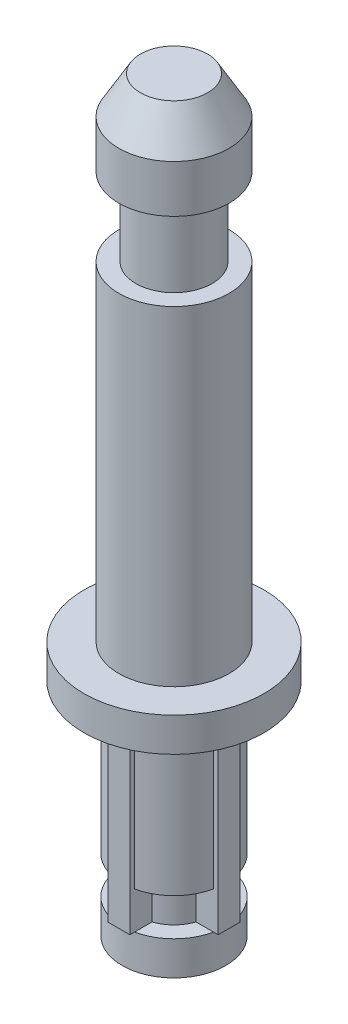
from build123d import *
from build123d.topology import SkipClean

# Parameters (mm, degrees)
SKETCH_1_R          = 3.25
EXTRUDE_1_DEPTH     = 29
CUT_EXTRUDE_START   = -5
SKETCH_2_OUTSIDE_W  = 14.584
SKETCH_2_OUTSIDE_H  = 14.584
SKETCH_2_OUTSIDE_R  = 2.25
CUT_EXTRUDE_1_DEPTH = 4.6
CHAMFER_1_SIZE      = 2.2
CHAMFER_1_SIZE2     = 1.270170592
SKETCH_3_R          = 5.3
EXTRUDE_2_DEPTH     = 2
EXTRUDE_3_DEPTH     = 13
CUT_EXTRUDE_START_2 = -4.2
CUT_EXTRUDE_2_DEPTH = 2.2
SKETCH_6_OUTSIDE_W  = 21.896
SKETCH_6_OUTSIDE_H  = 21.896
SKETCH_6_OUTSIDE_R  = 3.05
CUT_EXTRUDE_3_DEPTH = 2


with BuildPart() as part:
    # Эскиз1 → Бобышка-Вытянуть1 (new body)
    with BuildSketch(Plane(origin=(0, 0, 0), x_dir=(1, 0, 0), z_dir=(0, 1, 0))):
        with Locations(Location((0, 0, 0), (0, 0, 90))):
            Circle(SKETCH_1_R)
    extrude(amount=EXTRUDE_1_DEPTH)

    # Эскиз2 outside → Вырез-Вытянуть1 (cut)
    with BuildSketch(Plane(origin=(0, 29, 0), x_dir=(1, 0, 0), z_dir=(0, 1, 0)).offset(CUT_EXTRUDE_START)):
        Rectangle(SKETCH_2_OUTSIDE_W, SKETCH_2_OUTSIDE_H)
        with Locations(Location((0, 0, 0), (0, 0, 270))):
            Circle(SKETCH_2_OUTSIDE_R, mode=Mode.SUBTRACT)
    extrude(amount=-CUT_EXTRUDE_1_DEPTH, mode=Mode.SUBTRACT)

    # Фаска1
    chamfer_1_edges = [part.edges().sort_by_distance(p)[0] for p in [
        (0, 29, 3.25),
    ]]
    chamfer_1_side = [part.faces().sort_by_distance(p)[0] for p in [
        (0, 26.5, 3.25),
    ]]
    chamfer(chamfer_1_edges, length=CHAMFER_1_SIZE, length2=CHAMFER_1_SIZE2, reference=chamfer_1_side[0])

    # Эскиз3 → Бобышка-Вытянуть2 (add)
    with BuildSketch(Plane.XZ):
        with Locations(Location((0, 0, 0), (0, 0, 270))):
            Circle(SKETCH_3_R)
    extrude(amount=EXTRUDE_2_DEPTH)

    # Эскиз4 → Бобышка-Вытянуть3 (add)
    with BuildSketch(Plane.XZ.offset(2)):
        with BuildLine():
            Line((-0.65, 3.25), (0.65, 3.25))
            Line((0.65, 3.25), (0.65, 2.979932885))
            ThreePointArc((0.65, 2.979932885), (2.156675683, 2.156675683), (2.979932885, 0.65))
            Line((2.979932885, 0.65), (3.25, 0.65))
            Line((3.25, 0.65), (3.25, -0.65))
            Line((3.25, -0.65), (2.979932885, -0.65))
            ThreePointArc((2.979932885, -0.65), (2.156675683, -2.156675683), (0.65, -2.979932885))
            Line((0.65, -2.979932885), (0.65, -3.25))
            Line((0.65, -3.25), (-0.65, -3.25))
            Line((-0.65, -3.25), (-0.65, -2.979932885))
            ThreePointArc((-0.65, -2.979932885), (-2.156675683, -2.156675683), (-2.979932885, -0.65))
            Line((-2.979932885, -0.65), (-3.25, -0.65))
            Line((-3.25, -0.65), (-3.25, 0.65))
            Line((-3.25, 0.65), (-2.979932885, 0.65))
            ThreePointArc((-2.979932885, 0.65), (-2.156675683, 2.156675683), (-0.65, 2.979932885))
            Line((-0.65, 2.979932885), (-0.65, 3.25))
        make_face()
    extrude(amount=EXTRUDE_3_DEPTH)

    # Эскиз5 → Вырез-Вытянуть2 (cut)
    with BuildSketch(Plane.XZ.offset(15).offset(CUT_EXTRUDE_START_2)):
        with BuildLine():
            Line((-2.979932885, 0.65), (-1.94422221, 0.65))
            ThreePointArc((-1.94422221, 0.65), (-1.449568901, 1.449568901), (-0.65, 1.94422221))
            Line((-0.65, 1.94422221), (-0.65, 2.979932885))
            ThreePointArc((-0.65, 2.979932885), (-2.156675683, 2.156675683), (-2.979932885, 0.65))
        make_face()
        with BuildLine():
            Line((2.979932885, 0.65), (1.94422221, 0.65))
            ThreePointArc((1.94422221, 0.65), (1.449568901, 1.449568901), (0.65, 1.94422221))
            Line((0.65, 1.94422221), (0.65, 2.979932885))
            ThreePointArc((0.65, 2.979932885), (2.156675683, 2.156675683), (2.979932885, 0.65))
        make_face()
        with BuildLine():
            Line((-0.65, -1.94422221), (-0.65, -2.979932885))
            ThreePointArc((-0.65, -2.979932885), (-2.156675683, -2.156675683), (-2.979932885, -0.65))
            Line((-2.979932885, -0.65), (-1.94422221, -0.65))
            ThreePointArc((-1.94422221, -0.65), (-1.449568901, -1.449568901), (-0.65, -1.94422221))
        make_face()
        with BuildLine():
            Line((0.65, -2.979932885), (0.65, -1.94422221))
            ThreePointArc((0.65, -1.94422221), (1.449568901, -1.449568901), (1.94422221, -0.65))
            Line((1.94422221, -0.65), (2.979932885, -0.65))
            ThreePointArc((2.979932885, -0.65), (2.156675683, -2.156675683), (0.65, -2.979932885))
        make_face()
    extrude(amount=CUT_EXTRUDE_2_DEPTH, mode=Mode.SUBTRACT)

    # Эскиз6 outside → Вырез-Вытянуть3 (cut)
    with SkipClean():  # the faces are left unmerged after this step: merging them gives an invalid solid
        with BuildSketch(Plane.XZ.offset(15)):
            Rectangle(SKETCH_6_OUTSIDE_W, SKETCH_6_OUTSIDE_H)
            with Locations(Location((0, 0, 0), (0, 0, 102.304947534))):
                Circle(SKETCH_6_OUTSIDE_R, mode=Mode.SUBTRACT)
        extrude(amount=-CUT_EXTRUDE_3_DEPTH, mode=Mode.SUBTRACT)


solid = part.part
